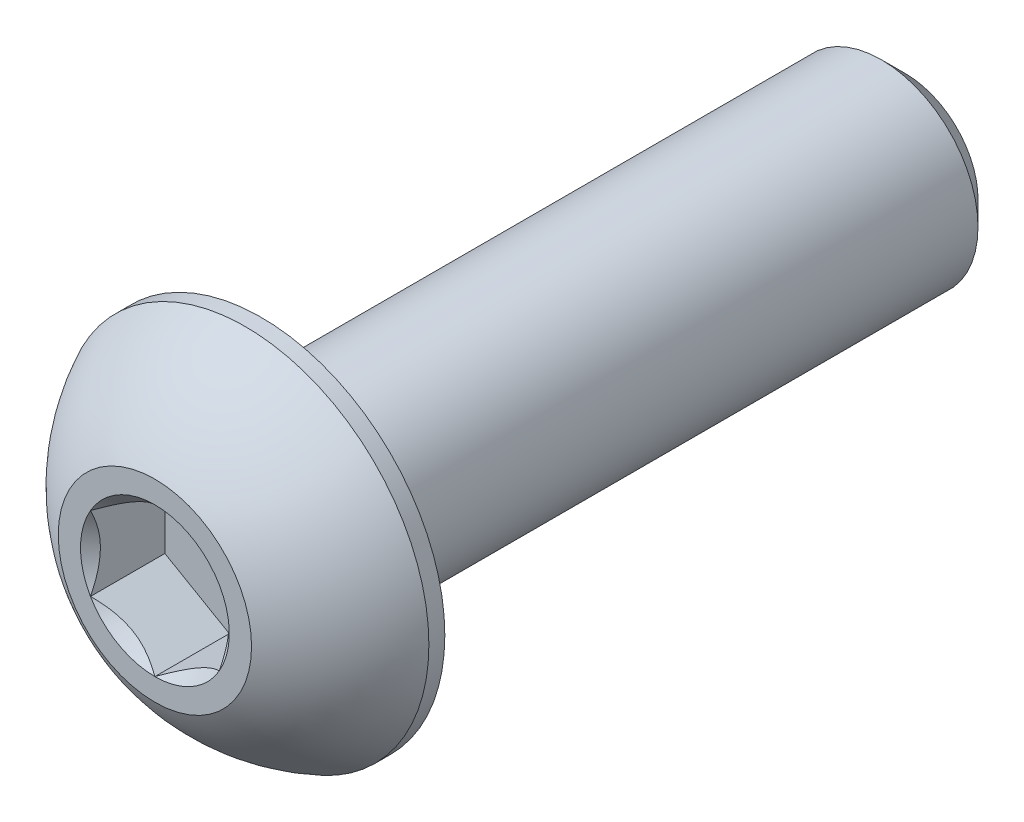
from build123d import *

# Parameters (mm, degrees)
SKETCH1_W          = 10
SKETCH1_H          = 1.5
CHAMFER1_SIZE      = 0.375
CUT_EXTRUDE2_DEPTH = 1.155


with BuildPart() as part:
    # Sketch1 → Revolve1 (revolve)
    with BuildSketch(Plane(origin=(0, 0, 0), x_dir=(0, 0, -1), z_dir=(1, 0, 0))):
        with Locations((6.65, 0.75)):
            Rectangle(SKETCH1_W, SKETCH1_H)
    revolve(axis=Axis((0, 0, -11.65), (0, 0, 1)))

    # Chamfer1
    chamfer1_edges = [part.edges().sort_by_distance(p)[0] for p in [
        (0, -1.5, -11.65),
    ]]
    chamfer(chamfer1_edges, length=CHAMFER1_SIZE)

    # Sketch7 → Revolve2 (revolve)
    with BuildSketch(Plane(origin=(0, 0, 0), x_dir=(0, 0, -1), z_dir=(1, 0, 0)), mode=Mode.PRIVATE) as revolve2_sk:
        with BuildLine():
            Line((1.4025, 2.85), (1.65, 2.85))
            Line((1.65, 2.85), (1.65, 0))
            Line((1.65, 0), (0, 0))
            Line((0, 0), (0, 1.5))
            ThreePointArc((0, 1.5), (0.59512511, 2.285251969), (1.4025, 2.85))
        make_face()
    revolve(revolve2_sk.sketch.rotate(Axis((0, 0, 0), (0, 0, -1)), 180), axis=Axis((0, 0, 0), (0, 0, -1)))

    # Sketch5 → Cut-Extrude2 (cut)
    with BuildSketch(Plane.XY):
        Polygon((1, -0.577350269), (1, 0.577350269), (0, 1.154700538), (-1, 0.577350269), (-1, -0.577350269), (0, -1.154700538), align=None)
    extrude(amount=-CUT_EXTRUDE2_DEPTH, mode=Mode.SUBTRACT)

    # Cut-Extrude3 cone 1 section (through the dimple's axis) → Cut-Extrude3 (revolve, cut)
    with BuildSketch(Plane(origin=(0, 0, 0), x_dir=(0, -1, 0), z_dir=(1, 0, 0))):
        Polygon((0, 0), (1.154700538, 0), (0, 1.154700538), align=None)
    revolve(axis=Axis((0, 0, 0), (0, 0, -1)), mode=Mode.SUBTRACT)


solid = part.part
